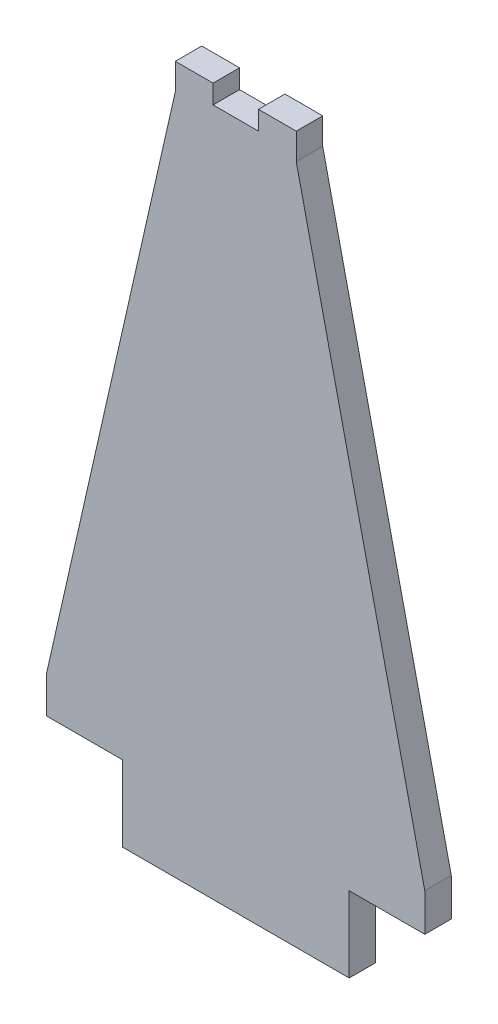
from build123d import *

# Parameters (mm, degrees)
BOSS_EXTRUDE1_DEPTH = 0.175


with BuildPart() as part:
    # frame_outline → Boss-Extrude1 (new, symmetric)
    with BuildSketch(Plane.XY):
        Polygon((0, 0), (3, 0), (3, 1), (4, 1), (4, 1.5), (2.3, 9), (2.3, 9.35), (1.8, 9.35), (1.8, 9.1), (1.2, 9.1), (1.2, 9.35), (0.7, 9.35), (0.7, 9), (-1, 1.5), (-1, 1), (0, 1), align=None)
    extrude(amount=BOSS_EXTRUDE1_DEPTH, both=True)


solid = part.part
